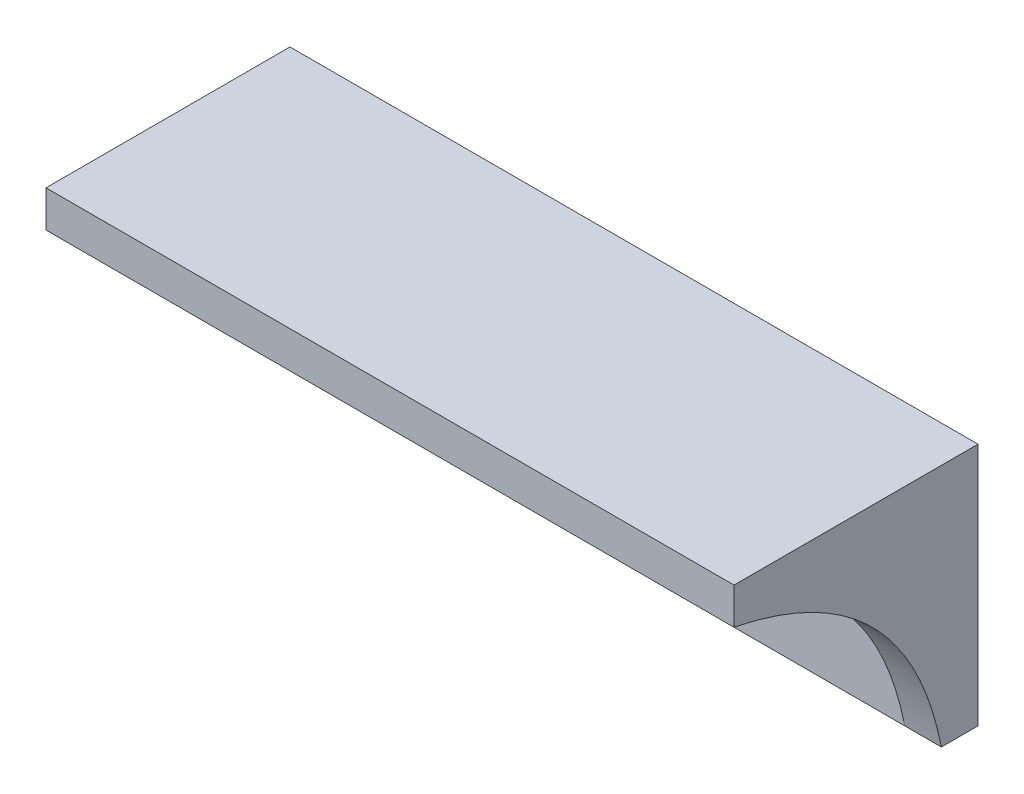
from build123d import *

# Parameters (mm, degrees)
SKETCH_1_W             = 56.4
SKETCH_1_H             = 20
EXTRUDE_1_DEPTH        = 3
SKETCH_2_W             = 56.4
SKETCH_2_H             = 3
EXTRUDE_2_DEPTH        = 17
EXTRUDE_3_DEPTH        = 3
PATTERN_LINEAR_1_COUNT = 3
PATTERN_LINEAR_1_PITCH = 26.7
HOLE_WIZARD_M4_1_D     = 4.5


with BuildPart() as part:
    # 스케치1 → 보스-돌출1 (new body)
    with BuildSketch(Plane.XY):
        Rectangle(SKETCH_1_W, SKETCH_1_H)
    extrude(amount=EXTRUDE_1_DEPTH)

    # 스케치2 → 보스-돌출2 (add)
    with BuildSketch(Plane.XY.offset(3)):
        with Locations((0, 8.5)):
            Rectangle(SKETCH_2_W, SKETCH_2_H)
    extrude(amount=EXTRUDE_2_DEPTH)

    # 스케치4 → 보스-돌출3 (add)
    with BuildSketch(Plane.ZY.offset(28.2)):
        with BuildLine():
            Line((3, -10), (3, 7))
            Line((3, 7), (20, 7))
            add(Edge.make_bspline(
                [(3, -10), (5.833333333, 4.166666667), (20, 7)],
                knots=[0, 0, 0, 1, 1, 1], degree=2))
        make_face()
    extrude_3 = extrude(amount=-EXTRUDE_3_DEPTH)

    # 선형 패턴1: 보스-돌출3 ×3
    with Locations(*[(i * PATTERN_LINEAR_1_PITCH, 0, 0) for i in range(1, PATTERN_LINEAR_1_COUNT)]):
        add(extrude_3)

    # M4 여유 구멍1 (through all)
    with Locations(Plane.XY.offset(3)):
        with Locations((-13.35, 0), (13.35, 0)):
            Hole(HOLE_WIZARD_M4_1_D / 2)


solid = part.part
